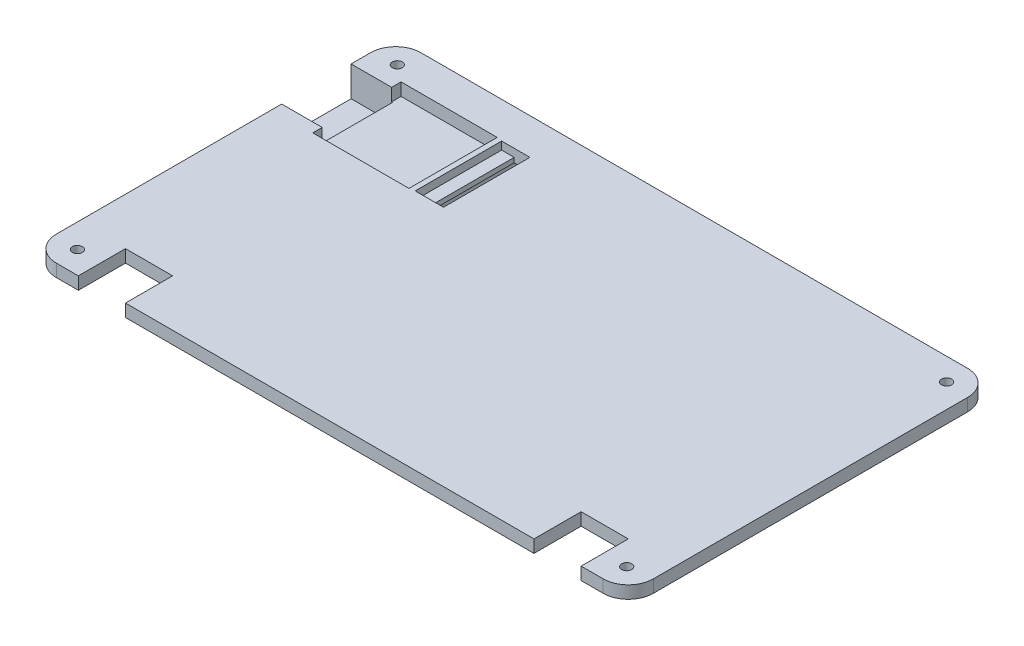
from build123d import *

# Parameters (mm, degrees)
SKETCH_1_W          = 272.533053494
SKETCH_1_H          = 136.587531522
EXTRUDE_1_DEPTH     = 4
SKETCH_2_W          = 272.533053494
SKETCH_2_H          = 136.587531522
CUT_EXTRUDE_1_DEPTH = 4
CUT_EXTRUDE_2_DEPTH = 4
CUT_EXTRUDE_3_DEPTH = 4
SKETCH_5_W          = 34
SKETCH_5_H          = 36
EXTRUDE_2_DEPTH     = 4
SKETCH_6_W          = 13.2
SKETCH_6_H          = 4
EXTRUDE_3_DEPTH     = 5.6
SKETCH_7_W          = 17.2
SKETCH_7_H          = 30.1
EXTRUDE_4_DEPTH     = 4
SKETCH_8_W          = 5
SKETCH_8_H          = 27.5
CUT_EXTRUDE_4_DEPTH = 4
SKETCH_9_W          = 27.5
SKETCH_9_H          = 2.5
CUT_EXTRUDE_5_DEPTH = 4
SKETCH_10_R         = 1.6
CUT_EXTRUDE_6_DEPTH = 10
SKETCH_13_W         = 15
SKETCH_13_H         = 15
CUT_EXTRUDE_7_DEPTH = 5


with BuildPart() as part:
    # 草图1 → 凸台-拉伸1 (new body)
    with BuildSketch(Plane(origin=(0, 0, 0), x_dir=(1, 0, 0), z_dir=(0, 1, 0))):
        Rectangle(SKETCH_1_W, SKETCH_1_H)
    extrude(amount=EXTRUDE_1_DEPTH)

    # 草图2 → 切除-拉伸1 (cut)
    with BuildSketch(Plane(origin=(0, 4, 0), x_dir=(1, 0, 0), z_dir=(0, 1, 0))):
        Rectangle(SKETCH_2_W, SKETCH_2_H)
        with BuildLine():
            Line((-87, 58), (87, 58))
            ThreePointArc((87, 58), (92.656854249, 55.656854249), (95, 50))
            Line((95, 50), (95, -50))
            ThreePointArc((95, -50), (92.656854249, -55.656854249), (87, -58))
            Line((87, -58), (-87, -58))
            ThreePointArc((-87, -58), (-92.656854249, -55.656854249), (-95, -50))
            Line((-95, -50), (-95, 50))
            ThreePointArc((-95, 50), (-92.656854249, 55.656854249), (-87, 58))
        make_face(mode=Mode.SUBTRACT)
    extrude(amount=-CUT_EXTRUDE_1_DEPTH, mode=Mode.SUBTRACT)

    # 草图3 → 切除-拉伸2 (cut)
    with BuildSketch(Plane.XZ):
        Polygon((-95, -22), (-81.8, -22), (-81.8, -19), (-51.8, -19), (-51.8, -46.5), (-81.8, -46.5), (-81.8, -43.5), (-95, -43.5), align=None)
    extrude(amount=-CUT_EXTRUDE_2_DEPTH, mode=Mode.SUBTRACT)

    # 草图4 → 切除-拉伸3 (cut)
    with BuildSketch(Plane.XZ):
        Polygon((-51.5, -18.7), (-51.5, -46.8), (-82.1, -46.8), (-82.1, -43.8), (-95, -43.8), (-95, -21.7), (-82.1, -21.7), (-82.1, -18.7), align=None)
    extrude(amount=-CUT_EXTRUDE_3_DEPTH, mode=Mode.SUBTRACT)

    # 草图5 → 凸台-拉伸2 (add)
    with BuildSketch(Plane.XZ):
        with Locations((-64.8, -32.75)):
            Rectangle(SKETCH_5_W, SKETCH_5_H)
    extrude(amount=EXTRUDE_2_DEPTH)

    # 草图6 → 凸台-拉伸3 (add)
    with BuildSketch(Plane.XZ):
        with Locations((-88.4, -19.7)):
            Rectangle(SKETCH_6_W, SKETCH_6_H)
        with Locations((-88.4, -45.8)):
            Rectangle(SKETCH_6_W, SKETCH_6_H)
    extrude(amount=EXTRUDE_3_DEPTH)

    # 草图7 → 凸台-拉伸4 (add)
    with BuildSketch(Plane.XZ.offset(5.6)):
        with Locations((-86.4, -32.75)):
            Rectangle(SKETCH_7_W, SKETCH_7_H)
    extrude(amount=EXTRUDE_4_DEPTH)

    # 草图8 → 切除-拉伸4 (cut)
    with BuildSketch(Plane(origin=(0, 4, 0), x_dir=(1, 0, 0), z_dir=(0, 1, 0))):
        with Locations((-43.3, 32.75)):
            Rectangle(SKETCH_8_W, SKETCH_8_H)
    extrude(amount=-CUT_EXTRUDE_4_DEPTH, mode=Mode.SUBTRACT)

    # 草图9 → 切除-拉伸5 (cut)
    with BuildSketch(Plane(origin=(-45.8, 0, 0), x_dir=(0, 0, -1), z_dir=(1, 0, 0))):
        with Locations((32.75, 2.75)):
            Rectangle(SKETCH_9_W, SKETCH_9_H)
    extrude(amount=-CUT_EXTRUDE_5_DEPTH, mode=Mode.SUBTRACT)

    # 草图10 → 切除-拉伸6 (cut)
    with BuildSketch(Plane(origin=(0, 4, 0), x_dir=(1, 0, 0), z_dir=(0, 1, 0))):
        with Locations(Location((87.4, 50.9, 0), (0, 0, 270))):
            Circle(SKETCH_10_R)
        with Locations(Location((-87.4, 50.9, 0), (0, 0, 270))):
            Circle(SKETCH_10_R)
        with Locations(Location((-87.4, -50.9, 0), (0, 0, 270))):
            Circle(SKETCH_10_R)
        with Locations(Location((87.4, -50.9, 0), (0, 0, 270))):
            Circle(SKETCH_10_R)
    extrude(amount=-CUT_EXTRUDE_6_DEPTH, mode=Mode.SUBTRACT)

    # 草图13 → 切除-拉伸7 (cut, symmetric)
    with BuildSketch(Plane.XZ):
        with Locations((72.5, 50.5)):
            Rectangle(SKETCH_13_W, SKETCH_13_H)
        with Locations((-72.5, 50.5)):
            Rectangle(SKETCH_13_W, SKETCH_13_H)
    extrude(amount=CUT_EXTRUDE_7_DEPTH, both=True, mode=Mode.SUBTRACT)


solid = part.part
